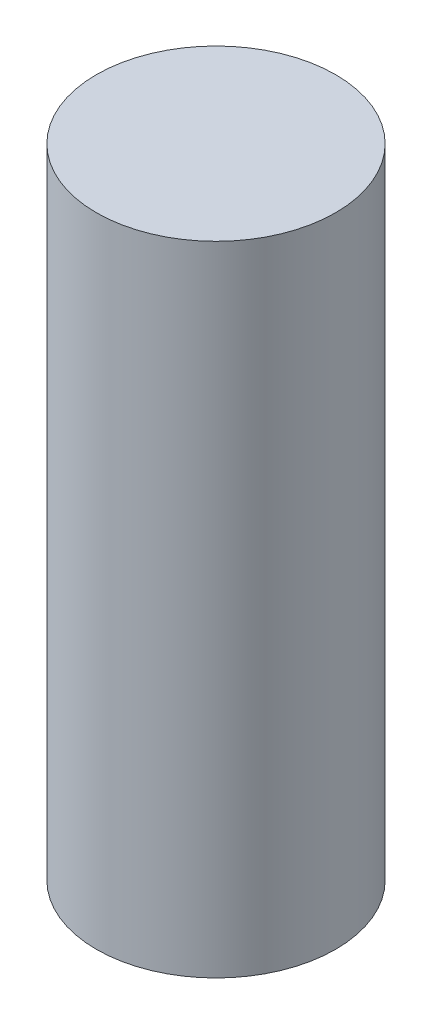
from build123d import *

# Parameters (mm, degrees)
SKETCH1_R           = 4.7625
BOSS_EXTRUDE1_DEPTH = 25.4


with BuildPart() as part:
    # Sketch1 → Boss-Extrude1 (new body)
    with BuildSketch(Plane(origin=(0, 0, 0), x_dir=(1, 0, 0), z_dir=(0, 1, 0))):
        with Locations(Location((0, 0, 0), (0, 0, 270))):
            Circle(SKETCH1_R)
    extrude(amount=BOSS_EXTRUDE1_DEPTH)


solid = part.part
